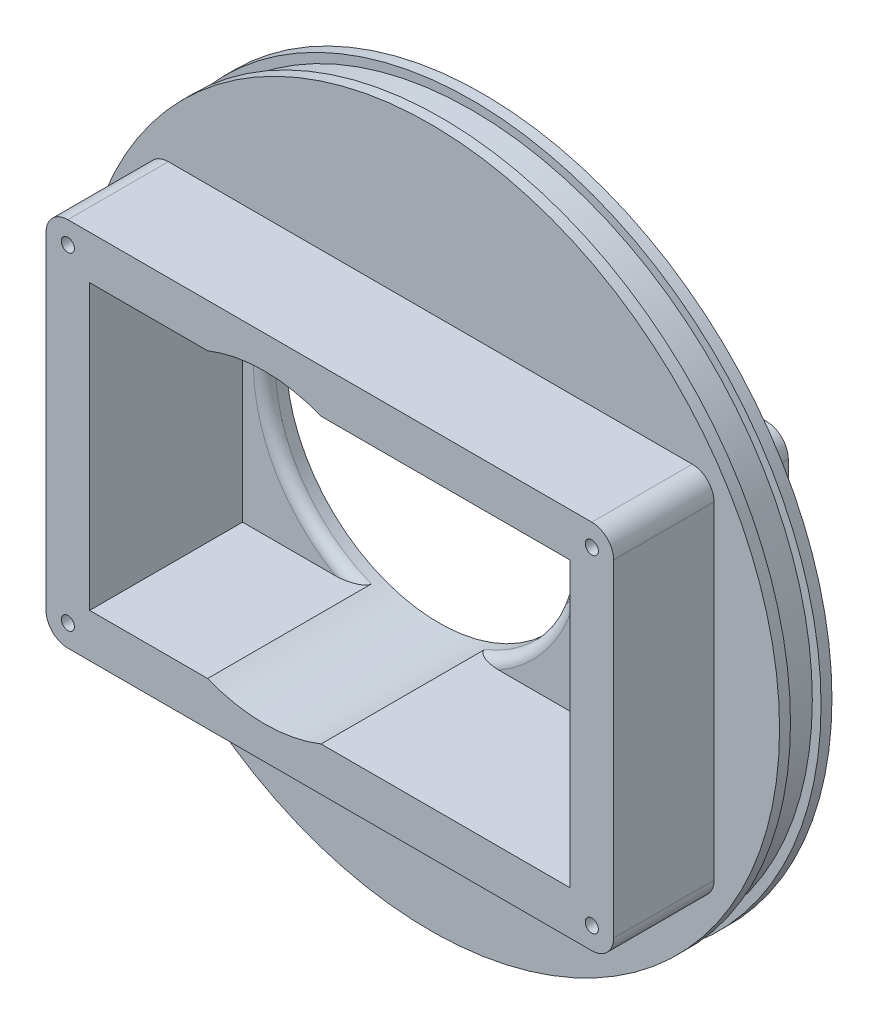
from build123d import *

# Parameters (mm, degrees)
SKETCH1_W           = 130
SKETCH1_H           = 85
SKETCH1_W_2         = 110
SKETCH1_H_2         = 65
BOSS_EXTRUDE1_DEPTH = 35
SKETCH2_W           = 130
SKETCH2_H           = 85
SKETCH2_R           = 35
SKETCH2_W_2         = 25
SKETCH2_H_2         = 65
BOSS_EXTRUDE2_DEPTH = 5
CUT_EXTRUDE1_START  = 45
SKETCH2_2_R         = 35
CUT_EXTRUDE1_DEPTH  = 45
SKETCH3_R           = 1.5
CUT_EXTRUDE2_DEPTH  = 15
FILLET1_R           = 5
FILLET2_R           = 2.5
SKETCH4_R           = 80
BOSS_EXTRUDE3_DEPTH = 12
SKETCH5_W           = 7
SKETCH5_H           = 2


with BuildPart() as part:
    # Sketch1 → Boss-Extrude1 (new body)
    with BuildSketch(Plane.XY):
        Rectangle(SKETCH1_W, SKETCH1_H)
        Rectangle(SKETCH1_W_2, SKETCH1_H_2, mode=Mode.SUBTRACT)
    extrude(amount=BOSS_EXTRUDE1_DEPTH)

    # Sketch2 → Boss-Extrude2 (add)
    with BuildSketch(Plane.XY):
        Rectangle(SKETCH2_W, SKETCH2_H)
        with Locations((-15, 0)):
            Circle(SKETCH2_R, mode=Mode.SUBTRACT)
        with Locations((42.5, 0)):
            Rectangle(SKETCH2_W_2, SKETCH2_H_2, mode=Mode.SUBTRACT)
    extrude(amount=-BOSS_EXTRUDE2_DEPTH)

    # Sketch2<2> → Cut-Extrude1 (cut)
    with BuildSketch(Plane.XY.offset(CUT_EXTRUDE1_START)):
        with Locations((-15, 0)):
            Circle(SKETCH2_2_R)
    extrude(amount=-CUT_EXTRUDE1_DEPTH, mode=Mode.SUBTRACT)

    # Sketch3 → Cut-Extrude2 (cut)
    with BuildSketch(Plane.XY.offset(35)):
        with Locations((-60, 37.5)):
            Circle(SKETCH3_R)
        with Locations((60, 37.5)):
            Circle(SKETCH3_R)
        with Locations((-60, -37.5)):
            Circle(SKETCH3_R)
        with Locations((60, -37.5)):
            Circle(SKETCH3_R)
    extrude(amount=-CUT_EXTRUDE2_DEPTH, mode=Mode.SUBTRACT)

    # Fillet1
    fillet1_edges = [part.edges().sort_by_distance(p)[0] for p in [
        (65, -42.5, 15),
        (-65, -42.5, 15),
        (65, 42.5, 15),
        (-65, 42.5, 15),
    ]]
    fillet(fillet1_edges, radius=FILLET1_R)

    # Fillet2
    fillet2_edges = [part.edges().sort_by_distance(p)[0] for p in [
        (30, 0, 0),
        (13.979849352, 19.625705886, 0),
        (-50, 0, 0),
    ]]
    fillet(fillet2_edges, radius=FILLET2_R)

    # Sketch4 → Boss-Extrude3 (add)
    with BuildSketch(Plane.XY):
        Circle(SKETCH4_R)
        Polygon((60, 42.5), (-60, 42.5), (-65, 37.5), (-65, -37.5), (-60, -42.5), (60, -42.5), (65, -37.5), (65, 37.5), align=None, mode=Mode.SUBTRACT)
    extrude(amount=BOSS_EXTRUDE3_DEPTH)

    # Sketch5 → Cut-Revolve1 (revolve, cut)
    with BuildSketch(Plane(origin=(0, 0, 0), x_dir=(0, 0, -1), z_dir=(1, 0, 0))):
        with Locations((-6, 79)):
            Rectangle(SKETCH5_W, SKETCH5_H)
    revolve(axis=Axis((0, 0, 0), (0, 0, -1)), mode=Mode.SUBTRACT)


solid = part.part
